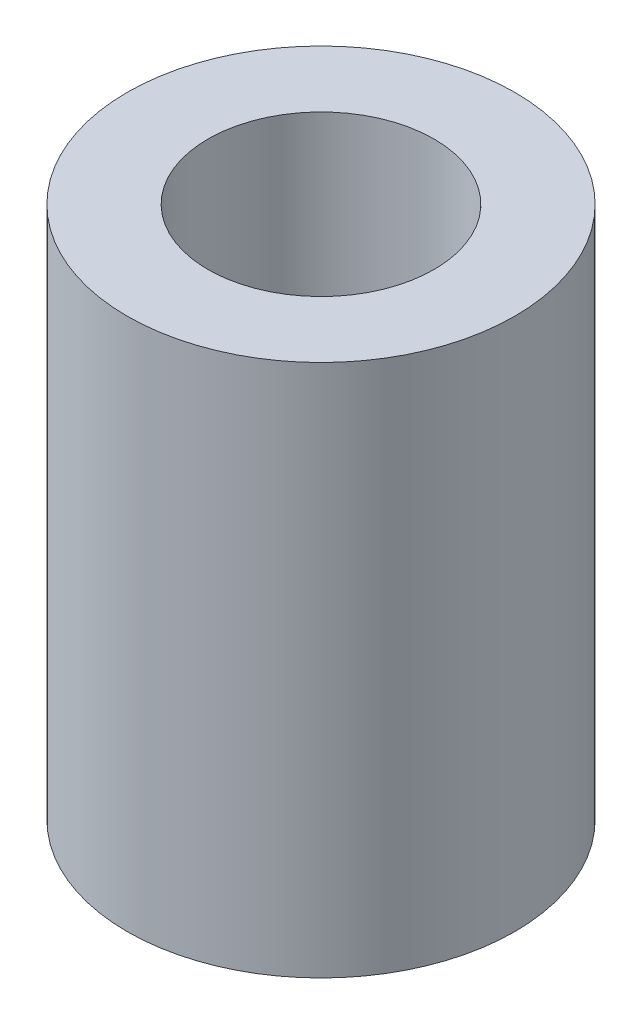
from build123d import *

# Parameters (mm, degrees)
SKETCH1_R           = 3.6
SKETCH1_R_2         = 2.1
BOSS_EXTRUDE1_DEPTH = 9.9


with BuildPart() as part:
    # Sketch1 → Boss-Extrude1 (new body)
    with BuildSketch(Plane(origin=(0, 0, 0), x_dir=(1, 0, 0), z_dir=(0, 1, 0))):
        with Locations(Location((0, 0, 0), (0, 0, 90))):
            Circle(SKETCH1_R)
        with Locations(Location((0, 0, 0), (0, 0, 90))):
            Circle(SKETCH1_R_2, mode=Mode.SUBTRACT)
    extrude(amount=BOSS_EXTRUDE1_DEPTH)


solid = part.part
